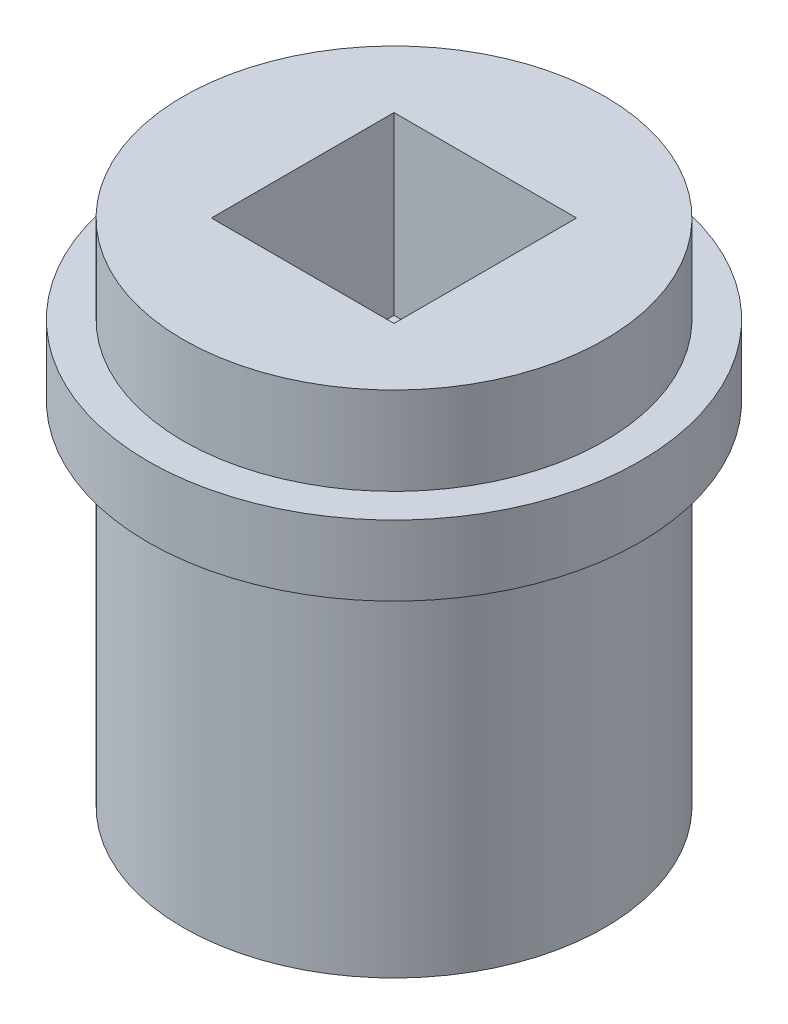
from build123d import *

# Parameters (mm, degrees)
SKIZZE1_R                       = 3
AUFSATZ_LINEAR_AUSTRAGEN1_DEPTH = 7.25
AUFSATZ_LINEAR_START            = 5
SKIZZE3_R                       = 3.5
AUFSATZ_LINEAR_AUSTRAGEN2_DEPTH = 1
SKIZZE2_W                       = 2.6
SKIZZE2_H                       = 2.6
SCHNITT_LINEAR_AUSTRAGEN1_DEPTH = 2.5


with BuildPart() as part:
    # Skizze1 → Aufsatz-Linear austragen1 (new body)
    with BuildSketch(Plane(origin=(0, 0, 0), x_dir=(1, 0, 0), z_dir=(0, 1, 0))):
        with Locations(Location((0, 0, 0), (0, 0, 90))):
            Circle(SKIZZE1_R)
    extrude(amount=AUFSATZ_LINEAR_AUSTRAGEN1_DEPTH)

    # Skizze3 → Aufsatz-Linear austragen2 (add)
    with BuildSketch(Plane(origin=(0, 0, 0), x_dir=(1, 0, 0), z_dir=(0, 1, 0)).offset(AUFSATZ_LINEAR_START)):
        with Locations(Location((0, 0, 0), (0, 0, 270))):
            Circle(SKIZZE3_R)
    extrude(amount=AUFSATZ_LINEAR_AUSTRAGEN2_DEPTH)

    # Skizze2 → Schnitt-Linear austragen1 (cut)
    with BuildSketch(Plane(origin=(0, 7.25, 0), x_dir=(1, 0, 0), z_dir=(0, 1, 0))):
        Rectangle(SKIZZE2_W, SKIZZE2_H)
    extrude(amount=-SCHNITT_LINEAR_AUSTRAGEN1_DEPTH, mode=Mode.SUBTRACT)


solid = part.part
